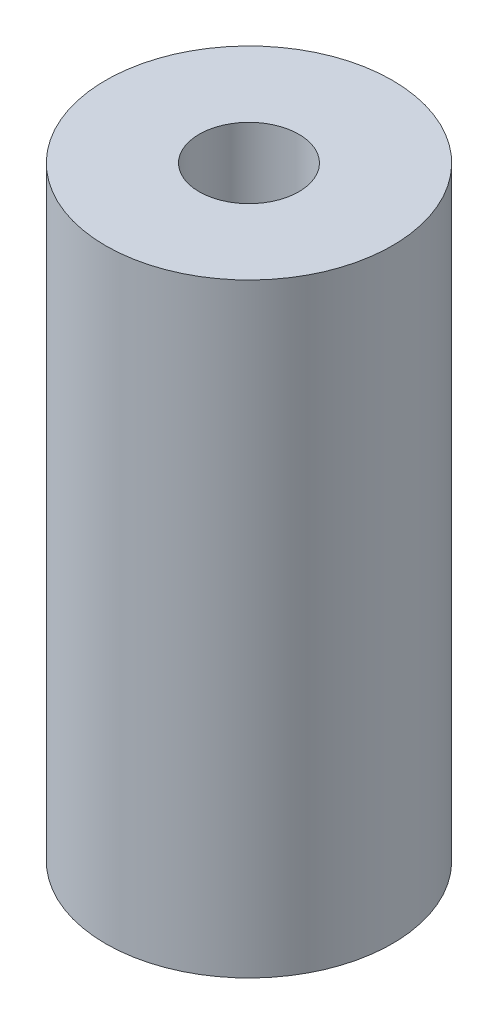
from build123d import *

# Parameters (mm, degrees)
SKETCH1_R           = 4.6
SKETCH1_R_2         = 1.6
BOSS_EXTRUDE1_DEPTH = 19.4


with BuildPart() as part:
    # Sketch1 → Boss-Extrude1 (new body)
    with BuildSketch(Plane(origin=(0, 0, 0), x_dir=(1, 0, 0), z_dir=(0, 1, 0))):
        with Locations(Location((0, 0, 0), (0, 0, 270))):
            Circle(SKETCH1_R)
        with Locations(Location((0, 0, 0), (0, 0, 270))):
            Circle(SKETCH1_R_2, mode=Mode.SUBTRACT)
    extrude(amount=BOSS_EXTRUDE1_DEPTH)


solid = part.part
